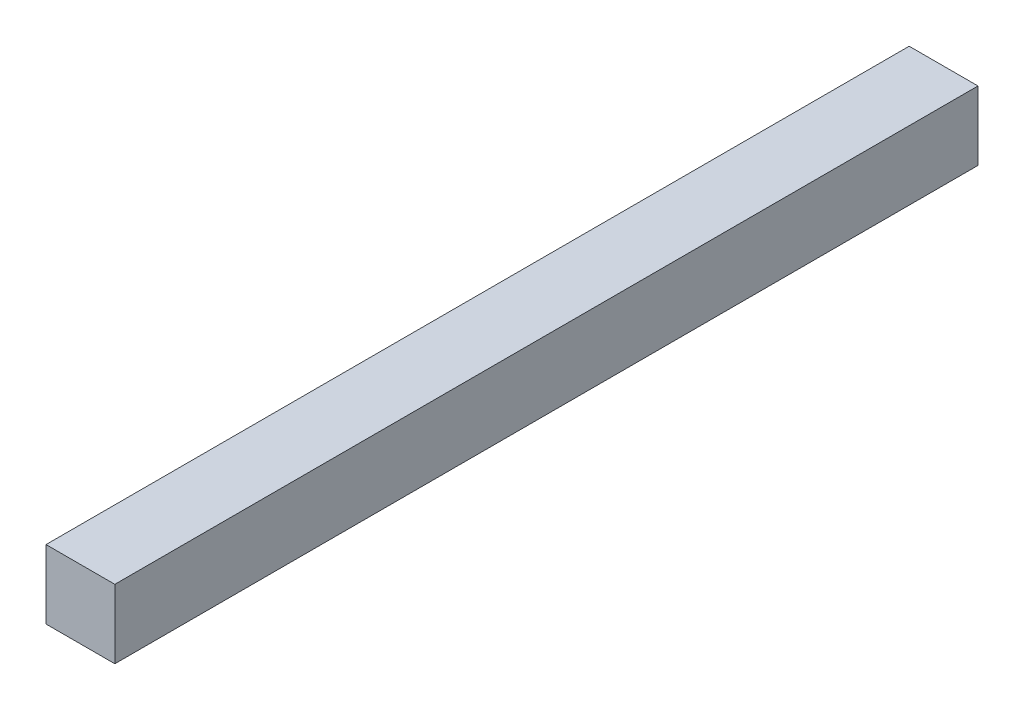
from build123d import *

# Parameters (mm, degrees)
SKETCH1_W           = 50
SKETCH1_H           = 50
BOSS_EXTRUDE1_DEPTH = 627
SKETCH2_R           = 5
CUT_EXTRUDE3_DEPTH  = 22


with BuildPart() as part:
    # Sketch1 → Boss-Extrude1 (new body)
    with BuildSketch(Plane.XY):
        Rectangle(SKETCH1_W, SKETCH1_H)
    extrude(amount=BOSS_EXTRUDE1_DEPTH)

    # Sketch2 → Cut-Extrude3 (cut)
    with BuildSketch(Plane.XY):
        Circle(SKETCH2_R)
    extrude(amount=CUT_EXTRUDE3_DEPTH, mode=Mode.SUBTRACT)


solid = part.part
